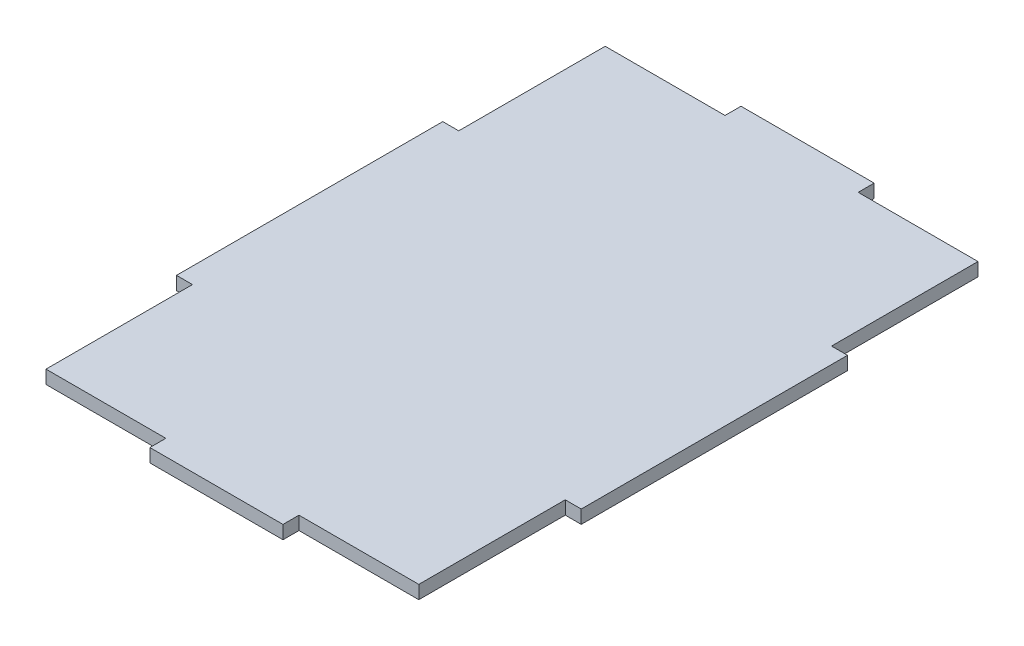
from build123d import *

# Parameters (mm, degrees)
BOSS_EXTRUDE1_DEPTH = 3.175


with BuildPart() as part:
    # Sketch2 → Boss-Extrude1 (new body)
    with BuildSketch(Plane(origin=(0, 0, 0), x_dir=(1, 0, 0), z_dir=(0, 1, 0))):
        Polygon((-44.45, 66.675), (-44.45, 31.75), (-48.26, 31.75), (-48.26, -31.75), (-44.45, -31.75), (-44.45, -66.675), (-15.875, -66.675), (-15.875, -70.485), (15.875, -70.485), (15.875, -66.675), (44.45, -66.675), (44.45, -31.75), (48.26, -31.75), (48.26, 31.75), (44.45, 31.75), (44.45, 66.675), (15.875, 66.675), (15.875, 70.485), (-15.875, 70.485), (-15.875, 66.675), align=None)
    extrude(amount=BOSS_EXTRUDE1_DEPTH)


solid = part.part
